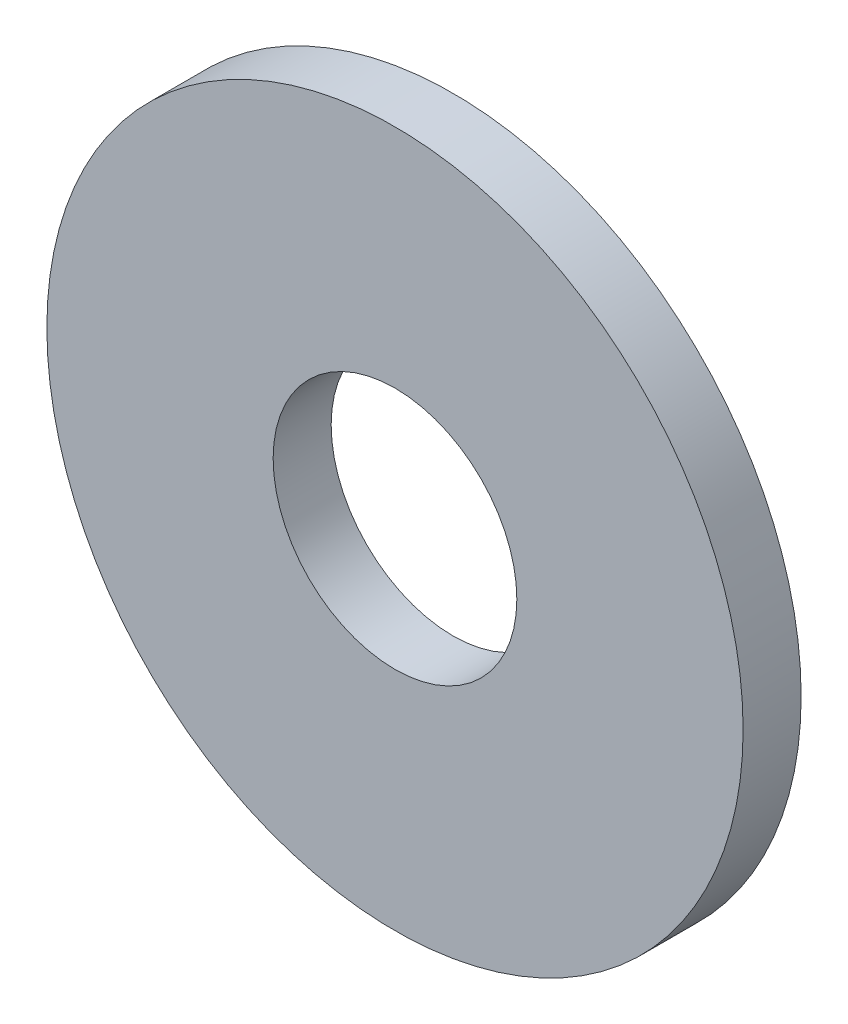
from build123d import *

# Parameters (mm, degrees)
SKETCH_1_R        = 30
SKETCH_1_R_2      = 10.5
EXTRUDE_148_DEPTH = 5


with BuildPart() as part:
    # Эскиз1 → Extrude 148 (new body)
    with BuildSketch(Plane.XY):
        Circle(SKETCH_1_R)
        Circle(SKETCH_1_R_2, mode=Mode.SUBTRACT)
    extrude(amount=EXTRUDE_148_DEPTH)


solid = part.part
